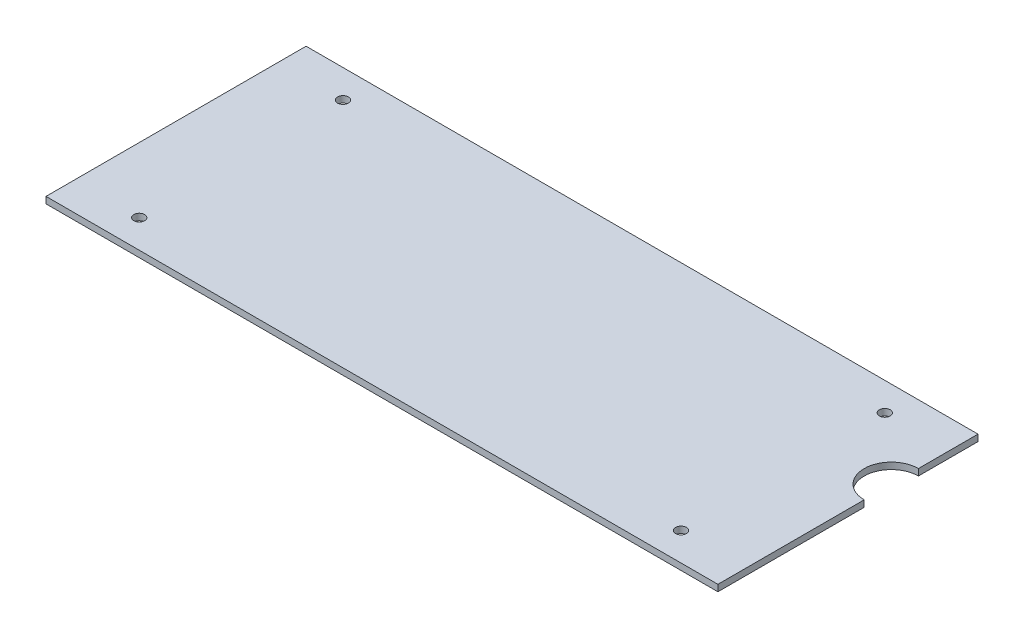
from build123d import *

# Parameters (mm, degrees)
SKETCH1_W           = 310
SKETCH1_H           = 120
SKETCH1_R           = 2.5
BOSS_EXTRUDE1_DEPTH = 3
CUT_EXTRUDE1_REACH  = 168.235
SKETCH2_R           = 12.5


with BuildPart() as part:
    # Sketch1 → Boss-Extrude1 (new body)
    with BuildSketch(Plane(origin=(0, 0, 0), x_dir=(1, 0, 0), z_dir=(0, 1, 0))):
        Rectangle(SKETCH1_W, SKETCH1_H)
        with Locations(Location((-125, 47, 0), (0, 0, 270))):
            Circle(SKETCH1_R, mode=Mode.SUBTRACT)
        with Locations(Location((125, 47, 0), (0, 0, 90))):
            Circle(SKETCH1_R, mode=Mode.SUBTRACT)
        with Locations(Location((125, -47, 0), (0, 0, 270))):
            Circle(SKETCH1_R, mode=Mode.SUBTRACT)
        with Locations(Location((-125, -47, 0), (0, 0, 90))):
            Circle(SKETCH1_R, mode=Mode.SUBTRACT)
    extrude(amount=BOSS_EXTRUDE1_DEPTH)

    # Sketch2 → Cut-Extrude1 (cut, up to next)
    with BuildSketch(Plane.XZ, mode=Mode.PRIVATE) as cut_extrude1_sk1:
        with Locations((155, -20)):
            Circle(SKETCH2_R)
    cut_extrude1_tool1 = extrude(cut_extrude1_sk1.sketch, amount=-CUT_EXTRUDE1_REACH, mode=Mode.PRIVATE) & part.part
    add(cut_extrude1_tool1.solids().sort_by_distance((155, 0, -20))[0], mode=Mode.SUBTRACT)


solid = part.part
